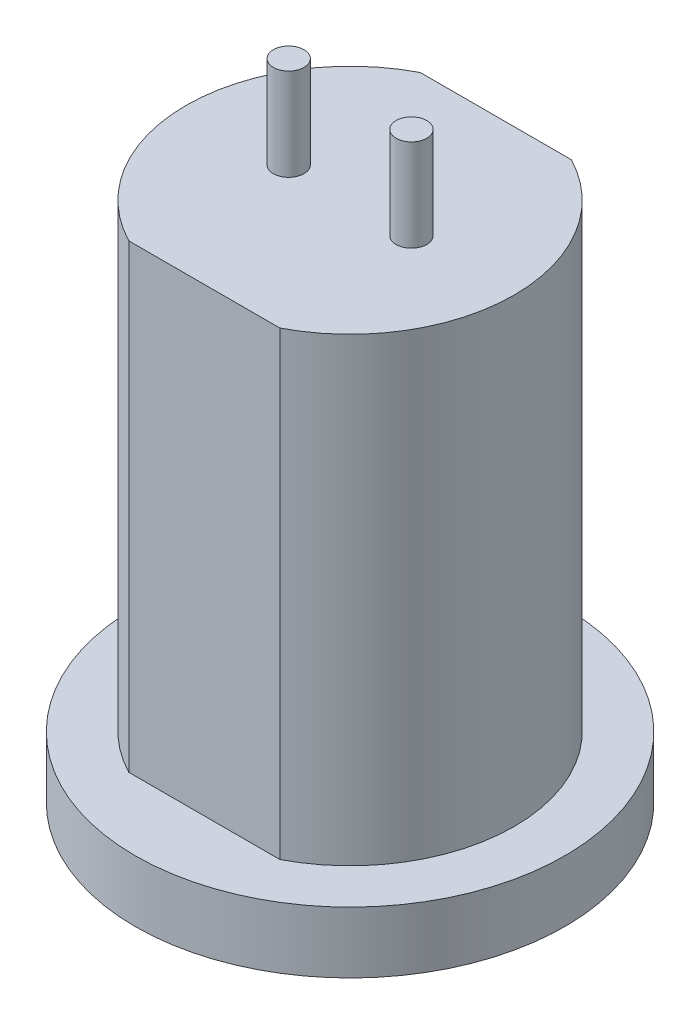
from build123d import *

# Parameters (mm, degrees)
SKETCH_1_R          = 7
EXTRUDE_1_DEPTH     = 2
EXTRUDE_2_DEPTH     = 15
SKETCH_3_R          = 0.5
EXTRUDE_3_DEPTH     = 3
CUT_EXTRUDE_1_DEPTH = 5


with BuildPart() as part:
    # 草图1 → 凸台-拉伸1 (new body)
    with BuildSketch(Plane(origin=(0, 0, 0), x_dir=(1, 0, 0), z_dir=(0, 1, 0))):
        with Locations(Location((0, 0, 0), (0, 0, 270))):
            Circle(SKETCH_1_R)
    extrude(amount=EXTRUDE_1_DEPTH)

    # 草图2 → 凸台-拉伸2 (add)
    with BuildSketch(Plane(origin=(0, 2, 0), x_dir=(1, 0, 0), z_dir=(0, 1, 0))):
        with BuildLine():
            Line((2.461706725, 4.75), (-2.461706725, 4.75))
            ThreePointArc((-2.461706725, 4.75), (-5.35, 0), (-2.461706725, -4.75))
            Line((-2.461706725, -4.75), (2.461706725, -4.75))
            ThreePointArc((2.461706725, -4.75), (4.571248789, -2.779601502), (5.35, 0))
            ThreePointArc((5.35, 0), (4.571248789, 2.779601502), (2.461706725, 4.75))
        make_face()
    extrude(amount=EXTRUDE_2_DEPTH)

    # 草图3 → 凸台-拉伸3 (add)
    with BuildSketch(Plane(origin=(0, 17, 0), x_dir=(1, 0, 0), z_dir=(0, 1, 0))):
        with Locations(Location((-2, 0, 0), (0, 0, 270))):
            Circle(SKETCH_3_R)
        with Locations(Location((2, 0, 0), (0, 0, 270))):
            Circle(SKETCH_3_R)
    extrude(amount=EXTRUDE_3_DEPTH)

    # 草图4 → 切除-拉伸1 (cut)
    with BuildSketch(Plane.XZ):
        with BuildLine():
            Line((-2.5, 1.5), (2.5, 1.5))
            ThreePointArc((2.5, 1.5), (4, 0), (2.5, -1.5))
            Line((2.5, -1.5), (-2.5, -1.5))
            ThreePointArc((-2.5, -1.5), (-4, 0), (-2.5, 1.5))
        make_face()
    extrude(amount=-CUT_EXTRUDE_1_DEPTH, mode=Mode.SUBTRACT)


solid = part.part
